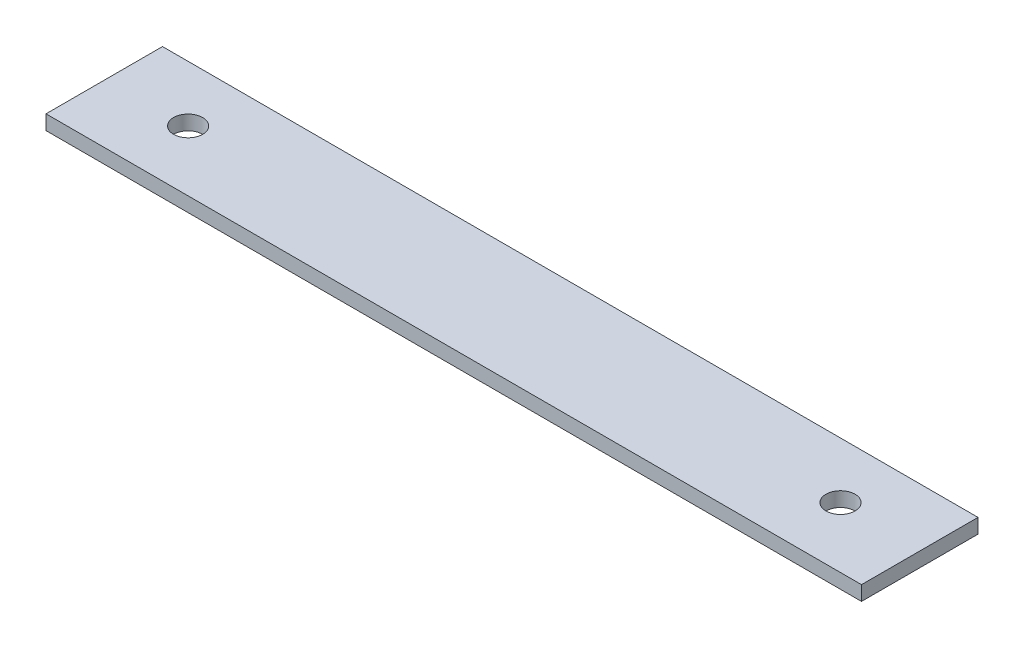
from build123d import *

# Parameters (mm, degrees)
SKETCH1_W           = 177.8
SKETCH1_H           = 25.4
SKETCH1_R           = 3.175
BOSS_EXTRUDE1_DEPTH = 3.175


with BuildPart() as part:
    # Sketch1 → Boss-Extrude1 (new body)
    with BuildSketch(Plane(origin=(0, 0, 0), x_dir=(1, 0, 0), z_dir=(0, 1, 0))):
        with Locations((-14.752862555, 11.258028356)):
            Rectangle(SKETCH1_W, SKETCH1_H)
        with Locations(Location((56.367137445, 11.76121392, 0), (0, 0, 270))):
            Circle(SKETCH1_R, mode=Mode.SUBTRACT)
        with Locations(Location((-85.872862555, 11.76121392, 0), (0, 0, 270))):
            Circle(SKETCH1_R, mode=Mode.SUBTRACT)
    extrude(amount=BOSS_EXTRUDE1_DEPTH)


solid = part.part
